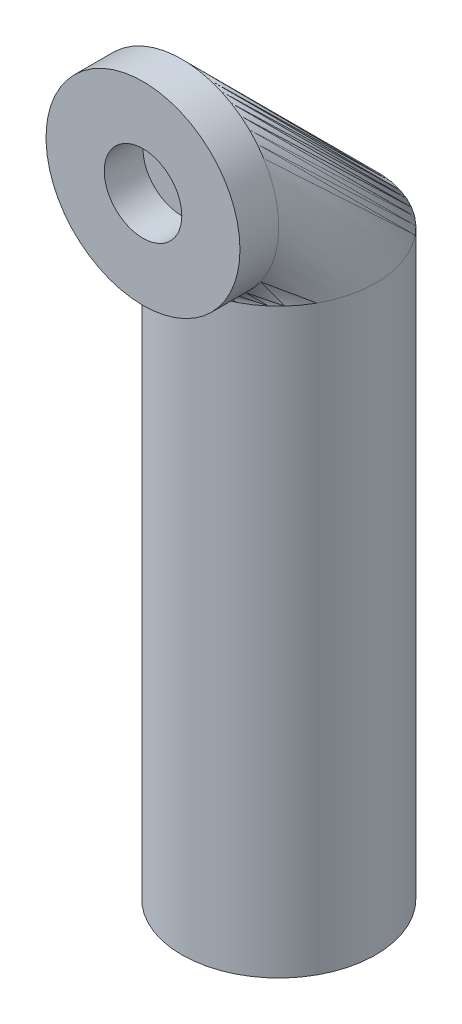
from build123d import *

# Parameters (mm, degrees)
SKETCH1_R           = 50
BOSS_EXTRUDE1_DEPTH = 300
SKETCH3_R           = 50
SKETCH4_R           = 50
BOSS_EXTRUDE2_DEPTH = 20
SKETCH5_R           = 20
CUT_EXTRUDE1_DEPTH  = 20
SKETCH9_R           = 20
CUT_EXTRUDE2_DEPTH  = 20


with BuildPart() as part:
    # Sketch1 → Boss-Extrude1 (new body)
    with BuildSketch(Plane(origin=(0, 0, 0), x_dir=(1, 0, 0), z_dir=(0, 1, 0))):
        with Locations(Location((0, 0, 0), (0, 0, 270))):
            Circle(SKETCH1_R)
    extrude(amount=BOSS_EXTRUDE1_DEPTH)

    # Sweep1: sweep along a path in Sketch2
    with BuildLine(Plane(origin=(0, 0, 0), x_dir=(0, 0, -1), z_dir=(1, 0, 0))) as sweep1_path:
        ThreePointArc((0, 300), (-14.644660941, 335.355339059), (-50, 350))
    # Sketch3 → Sweep1 (sweep)
    with BuildSketch(Plane(origin=(0, 300, 0), x_dir=(1, 0, 0), z_dir=(0, 1, 0))):
        Circle(SKETCH3_R)
    sweep(path=sweep1_path.line)

    # Sketch4 → Boss-Extrude2 (add)
    with BuildSketch(Plane.XY.offset(50)):
        with Locations(Location((0, 350, 0), (0, 0, 270))):
            Circle(SKETCH4_R)
    extrude(amount=BOSS_EXTRUDE2_DEPTH)

    # Sketch5 → Cut-Extrude1 (cut)
    with BuildSketch(Plane.XY.offset(70)):
        with Locations((0, 350)):
            Circle(SKETCH5_R)
    extrude(amount=-CUT_EXTRUDE1_DEPTH, mode=Mode.SUBTRACT)

    # Sketch9 → Cut-Extrude2 (cut)
    with BuildSketch(Plane.XZ):
        with Locations(Location((0, 0, 0), (0, 0, 270))):
            Circle(SKETCH9_R)
    extrude(amount=-CUT_EXTRUDE2_DEPTH, mode=Mode.SUBTRACT)


solid = part.part
